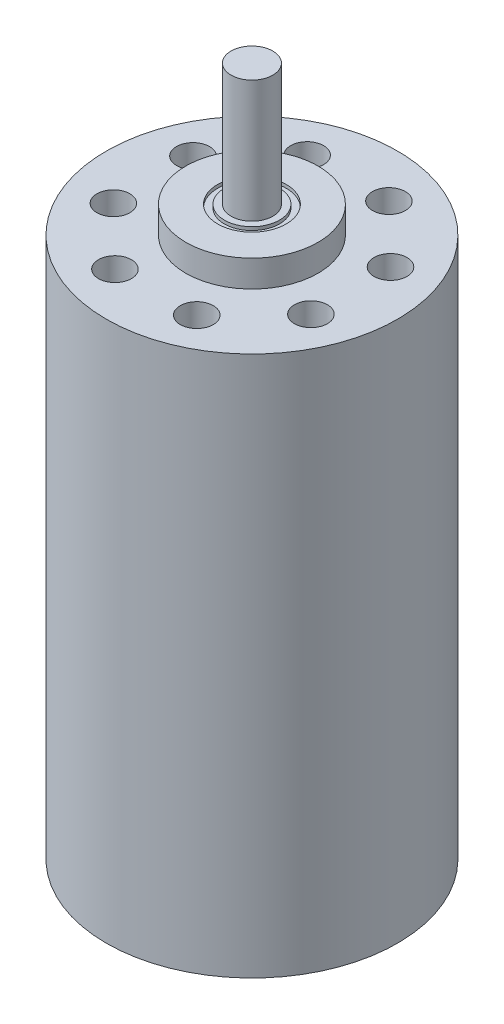
from build123d import *

# Parameters (mm, degrees)
SKETCH1_R           = 11.049
BOSS_EXTRUDE1_DEPTH = 40.9956
SKETCH2_R           = 5.0165
BOSS_EXTRUDE2_DEPTH = 2.032
SKETCH3_R           = 1.585
BOSS_EXTRUDE3_DEPTH = 9.271
SKETCH5_R           = 1.25
CUT_EXTRUDE4_DEPTH  = 3.175
SKETCH7_R           = 2.601
SKETCH7_R_2         = 2.093
CUT_EXTRUDE5_DEPTH  = 0.254


with BuildPart() as part:
    # Sketch1 → Boss-Extrude1 (new body)
    with BuildSketch(Plane(origin=(0, 0, 0), x_dir=(1, 0, 0), z_dir=(0, 1, 0))):
        with Locations(Location((0, 0, 0), (0, 0, 270))):
            Circle(SKETCH1_R)
    extrude(amount=BOSS_EXTRUDE1_DEPTH)

    # Sketch2 → Boss-Extrude2 (add)
    with BuildSketch(Plane(origin=(0, 40.9956, 0), x_dir=(1, 0, 0), z_dir=(0, 1, 0))):
        with Locations(Location((0, 0, 0), (0, 0, 270))):
            Circle(SKETCH2_R)
    extrude(amount=BOSS_EXTRUDE2_DEPTH)

    # Sketch3 → Boss-Extrude3 (add)
    with BuildSketch(Plane(origin=(0, 43.0276, 0), x_dir=(1, 0, 0), z_dir=(0, 1, 0))):
        with Locations(Location((0, 0, 0), (0, 0, 270))):
            Circle(SKETCH3_R)
    extrude(amount=BOSS_EXTRUDE3_DEPTH)

    # Sketch5 → Cut-Extrude4 (cut)
    with BuildSketch(Plane(origin=(0, 40.9956, 0), x_dir=(1, 0, 0), z_dir=(0, 1, 0))):
        with Locations(Location((-7.432335625, 2.959795122, 0), (0, 0, 270))):
            Circle(SKETCH5_R)
        with Locations(Location((-3.162563719, 7.348346122, 0), (0, 0, 270))):
            Circle(SKETCH5_R)
        with Locations(Location((2.959795122, 7.432335625, 0), (0, 0, 270))):
            Circle(SKETCH5_R)
        with Locations(Location((7.348346122, 3.162563719, 0), (0, 0, 270))):
            Circle(SKETCH5_R)
        with Locations(Location((7.432335625, -2.959795122, 0), (0, 0, 270))):
            Circle(SKETCH5_R)
        with Locations(Location((3.162563719, -7.348346122, 0), (0, 0, 270))):
            Circle(SKETCH5_R)
        with Locations(Location((-2.959795122, -7.432335625, 0), (0, 0, 270))):
            Circle(SKETCH5_R)
        with Locations(Location((-7.348346122, -3.162563719, 0), (0, 0, 270))):
            Circle(SKETCH5_R)
    extrude(amount=-CUT_EXTRUDE4_DEPTH, mode=Mode.SUBTRACT)

    # Sketch7 → Cut-Extrude5 (cut)
    with BuildSketch(Plane(origin=(0, 43.0276, 0), x_dir=(1, 0, 0), z_dir=(0, 1, 0))):
        with Locations(Location((0, 0, 0), (0, 0, 270))):
            Circle(SKETCH7_R)
        with Locations(Location((0, 0, 0), (0, 0, 270))):
            Circle(SKETCH7_R_2, mode=Mode.SUBTRACT)
    extrude(amount=-CUT_EXTRUDE5_DEPTH, mode=Mode.SUBTRACT)


solid = part.part
